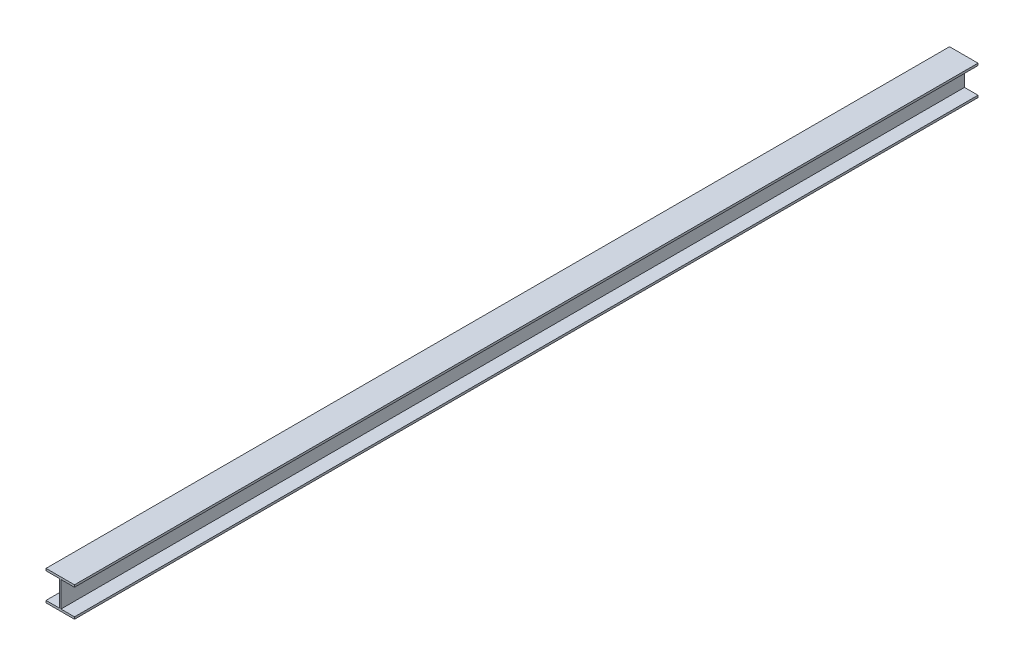
from build123d import *

# Parameters (mm, degrees)
BOSS_EXTRUDE1_DEPTH = 4900


with BuildPart() as part:
    # Sketch1 → Boss-Extrude1 (new body)
    with BuildSketch(Plane.XY):
        Polygon((0, -0.000240533), (154.432, -0.000240533), (154.432, -11.557240533), (81.28, -11.557240533), (81.28, -150.495240533), (154.432, -150.495240533), (154.432, -162.052240533), (0, -162.052240533), (0, -150.495240533), (73.152, -150.495240533), (73.152, -11.557240533), (0, -11.557240533), align=None)
    extrude(amount=BOSS_EXTRUDE1_DEPTH)


solid = part.part
